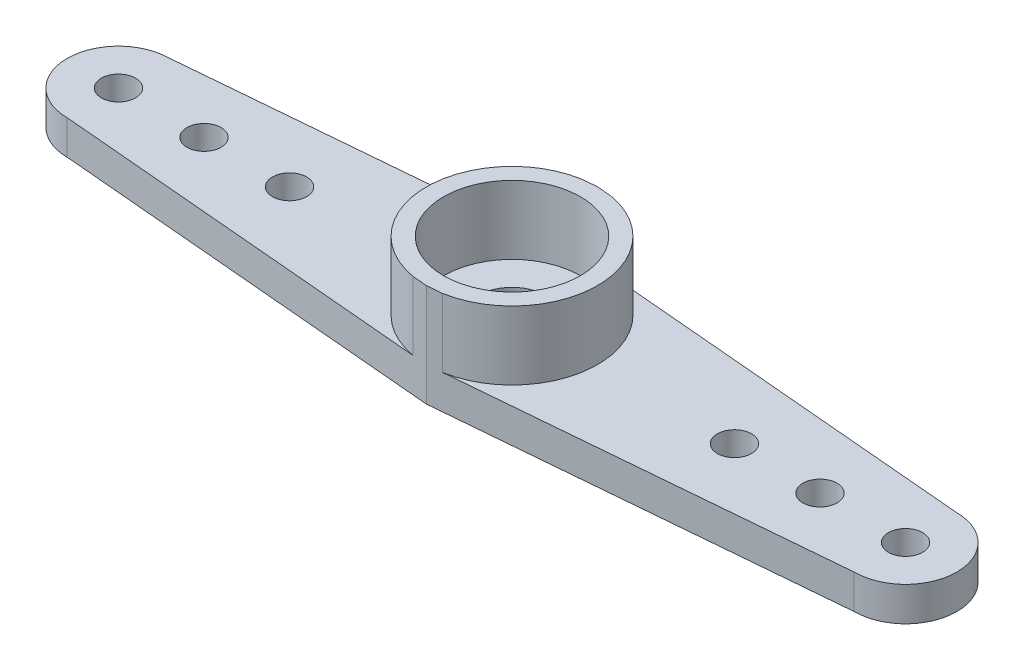
from build123d import *

# Parameters (mm, degrees)
SKETCH1_R           = 0.5
SKETCH1_R_2         = 1
BOSS_EXTRUDE1_DEPTH = 1
SKETCH1_4_R         = 2
BOSS_EXTRUDE2_DEPTH = 3


with BuildPart() as part:
    # Sketch1 → Boss-Extrude1 (new body)
    with BuildSketch(Plane(origin=(0, 0, 0), x_dir=(1, 0, 0), z_dir=(0, 1, 0))):
        with BuildLine():
            ThreePointArc((11.5, -1.5), (13, 0), (11.5, 1.5))
            Line((11.5, 1.5), (0, 2.5))
            Line((0, 2.5), (-11.5, 1.5))
            ThreePointArc((-11.5, 1.5), (-13, 0), (-11.5, -1.5))
            Line((-11.5, -1.5), (0, -2.5))
            Line((0, -2.5), (11.5, -1.5))
        make_face()
        with Locations((6.5, 0)):
            Circle(SKETCH1_R, mode=Mode.SUBTRACT)
        with Locations((9, 0)):
            Circle(SKETCH1_R, mode=Mode.SUBTRACT)
        with Locations((11.5, 0)):
            Circle(SKETCH1_R, mode=Mode.SUBTRACT)
        Circle(SKETCH1_R_2, mode=Mode.SUBTRACT)
        with Locations((-6.5, 0)):
            Circle(SKETCH1_R, mode=Mode.SUBTRACT)
        with Locations((-9, 0)):
            Circle(SKETCH1_R, mode=Mode.SUBTRACT)
        with Locations((-11.5, 0)):
            Circle(SKETCH1_R, mode=Mode.SUBTRACT)
    extrude(amount=BOSS_EXTRUDE1_DEPTH)

    # Sketch1<4> → Boss-Extrude2 (add)
    with BuildSketch(Plane(origin=(0, 0, 0), x_dir=(1, 0, 0), z_dir=(0, 1, 0))):
        with BuildLine():
            ThreePointArc((2.5, 0), (1.914262162, 1.607980216), (0.4315197, 2.462476548))
            Line((0.4315197, 2.462476548), (0, 2.5))
            Line((0, 2.5), (-0.4315197, 2.462476548))
            ThreePointArc((-0.4315197, 2.462476548), (-2.5, 0), (-0.4315197, -2.462476548))
            Line((-0.4315197, -2.462476548), (0, -2.5))
            Line((0, -2.5), (0.4315197, -2.462476548))
            ThreePointArc((0.4315197, -2.462476548), (1.914262162, -1.607980216), (2.5, 0))
        make_face()
        Circle(SKETCH1_4_R, mode=Mode.SUBTRACT)
    extrude(amount=BOSS_EXTRUDE2_DEPTH)


solid = part.part
